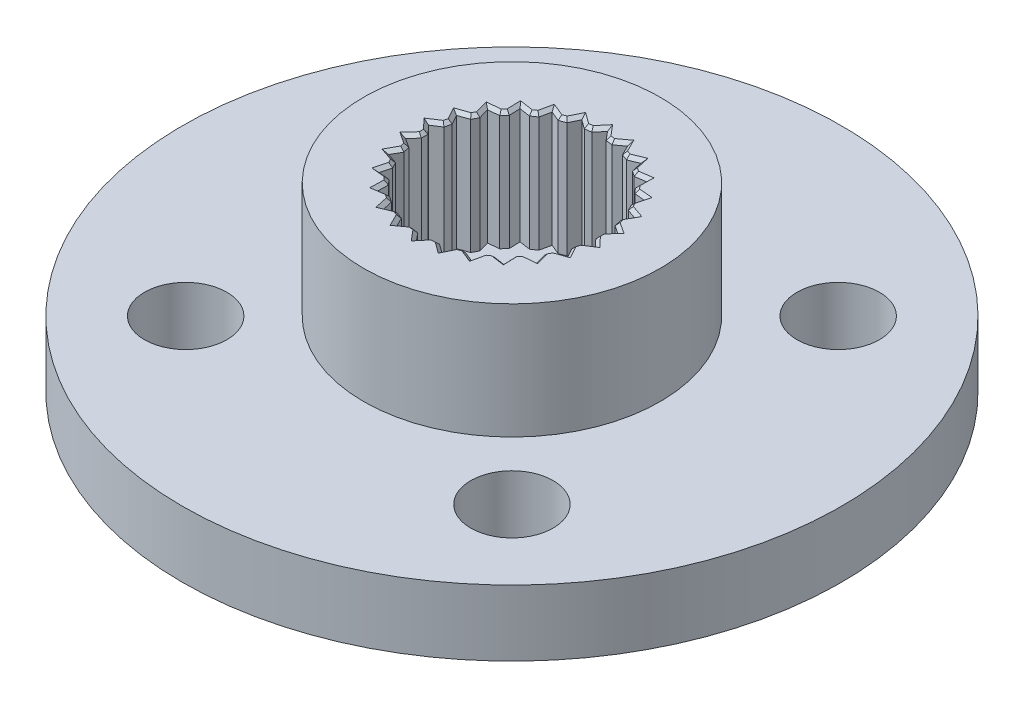
from build123d import *

# Parameters (mm, degrees)
SKETCH1_R           = 10
SKETCH1_R_2         = 1.25
SKETCH1_R_3         = 1.5
BOSS_EXTRUDE1_DEPTH = 2
SKETCH2_R           = 4.5
SKETCH2_R_2         = 1.5
BOSS_EXTRUDE2_DEPTH = 3.5
SKETCH3_R           = 2.25
CUT_EXTRUDE1_DEPTH  = 3.6
CUT_EXTRUDE2_DEPTH  = 3.6
CHAMFER1_SIZE       = 0.1


with BuildPart() as part:
    # Sketch1 → Boss-Extrude1 (new body)
    with BuildSketch(Plane(origin=(0, 0, 0), x_dir=(1, 0, 0), z_dir=(0, 1, 0))):
        with Locations(Location((0, 0, 0), (0, 0, 270))):
            Circle(SKETCH1_R)
        with Locations(Location((-4.949747468, 4.949747468, 0), (0, 0, 270))):
            Circle(SKETCH1_R_2, mode=Mode.SUBTRACT)
        with Locations(Location((4.949747468, 4.949747468, 0), (0, 0, 270))):
            Circle(SKETCH1_R_2, mode=Mode.SUBTRACT)
        with Locations(Location((4.949747468, -4.949747468, 0), (0, 0, 270))):
            Circle(SKETCH1_R_2, mode=Mode.SUBTRACT)
        with Locations(Location((-4.949747468, -4.949747468, 0), (0, 0, 270))):
            Circle(SKETCH1_R_2, mode=Mode.SUBTRACT)
        with Locations(Location((0, 0, 0), (0, 0, 270))):
            Circle(SKETCH1_R_3, mode=Mode.SUBTRACT)
    extrude(amount=BOSS_EXTRUDE1_DEPTH)

    # Sketch2 → Boss-Extrude2 (add)
    with BuildSketch(Plane(origin=(0, 2, 0), x_dir=(1, 0, 0), z_dir=(0, 1, 0))):
        with Locations(Location((0, 0, 0), (0, 0, 270))):
            Circle(SKETCH2_R)
        with Locations(Location((0, 0, 0), (0, 0, 270))):
            Circle(SKETCH2_R_2, mode=Mode.SUBTRACT)
    extrude(amount=BOSS_EXTRUDE2_DEPTH)

    # Sketch3 → Cut-Extrude1 (cut)
    with BuildSketch(Plane(origin=(0, 5.5, 0), x_dir=(1, 0, 0), z_dir=(0, 1, 0))):
        with Locations(Location((0, 0, 0), (0, 0, 270))):
            Circle(SKETCH3_R)
    extrude(amount=-CUT_EXTRUDE1_DEPTH, mode=Mode.SUBTRACT)

    # Sketch7 → Cut-Extrude2 (cut)
    with BuildSketch(Plane(origin=(0, 5.5, 0), x_dir=(1, 0, 0), z_dir=(0, 1, 0))):
        Polygon((-0.842998944, 2.512340101), (-1.034995876, 2.439525269), (-1.129082655, 2.478127827), (-1.347697199, 2.567822474), (-1.398067166, 2.336953865), (-1.419745267, 2.237593211), (-1.588737387, 2.120946373), (-1.689328372, 2.13591077), (-1.923055709, 2.17068117), (-1.916711542, 1.93446686), (-1.913981155, 1.832805537), (-2.050147256, 1.679105783), (-2.151396465, 1.669562343), (-2.386653211, 1.647387766), (-2.32396361, 1.419555673), (-2.296983416, 1.321501868), (-2.392410018, 1.139681668), (-2.488433215, 1.106185022), (-2.711547104, 1.028354172), (-2.59615536, 0.82214507), (-2.54649335, 0.733397313), (-2.595634607, 0.534023397), (-2.680851271, 0.478520248), (-2.878855735, 0.349556373), (-2.717467997, 0.176954384), (-2.648010346, 0.102670372), (-2.648010346, -0.102670372), (-2.717467997, -0.176954384), (-2.878855735, -0.349556373), (-2.680851271, -0.478520248), (-2.595634607, -0.534023397), (-2.54649335, -0.733397313), (-2.59615536, -0.82214507), (-2.711547104, -1.028354172), (-2.488433215, -1.106185022), (-2.392410018, -1.139681668), (-2.296983416, -1.321501868), (-2.32396361, -1.419555673), (-2.386653211, -1.647387766), (-2.151396465, -1.669562343), (-2.050147256, -1.679105783), (-1.913981155, -1.832805537), (-1.916711542, -1.93446686), (-1.923055709, -2.17068117), (-1.689328372, -2.13591077), (-1.588737387, -2.120946373), (-1.419745267, -2.237593211), (-1.398067166, -2.336953865), (-1.347697199, -2.567822474), (-1.129082655, -2.478127827), (-1.034995876, -2.439525269), (-0.842998944, -2.512340101), (-0.798172209, -2.603625605), (-0.694015426, -2.815731271), (-0.503218758, -2.676325101), (-0.421104166, -2.616327824), (-0.217260587, -2.641078915), (-0.151890384, -2.718984089), (0, -2.9), (0.151890384, -2.718984089), (0.217260587, -2.641078915), (0.421104166, -2.616327824), (0.503218758, -2.676325101), (0.694015426, -2.815731271), (0.798172209, -2.603625605), (0.842998944, -2.512340101), (1.034995876, -2.439525269), (1.129082655, -2.478127827), (1.347697199, -2.567822474), (1.398067166, -2.336953865), (1.419745267, -2.237593211), (1.588737387, -2.120946373), (1.689328372, -2.13591077), (1.923055709, -2.17068117), (1.916711542, -1.93446686), (1.913981155, -1.832805537), (2.050147256, -1.679105783), (2.151396465, -1.669562343), (2.386653211, -1.647387766), (2.32396361, -1.419555673), (2.296983416, -1.321501868), (2.392410018, -1.139681668), (2.488433215, -1.106185022), (2.711547104, -1.028354172), (2.59615536, -0.82214507), (2.54649335, -0.733397313), (2.595634607, -0.534023397), (2.680851271, -0.478520248), (2.878855735, -0.349556373), (2.717467997, -0.176954384), (2.648010346, -0.102670372), (2.648010346, 0.102670372), (2.717467997, 0.176954384), (2.878855735, 0.349556373), (2.680851271, 0.478520248), (2.595634607, 0.534023397), (2.54649335, 0.733397313), (2.59615536, 0.82214507), (2.711547104, 1.028354172), (2.488433215, 1.106185022), (2.392410018, 1.139681668), (2.296983416, 1.321501868), (2.32396361, 1.419555673), (2.386653211, 1.647387766), (2.151396465, 1.669562343), (2.050147256, 1.679105783), (1.913981155, 1.832805537), (1.916711542, 1.93446686), (1.923055709, 2.17068117), (1.689328372, 2.13591077), (1.588737387, 2.120946373), (1.419745267, 2.237593211), (1.398067166, 2.336953865), (1.347697199, 2.567822474), (1.129082655, 2.478127827), (1.034995876, 2.439525269), (0.842998944, 2.512340101), (0.798172209, 2.603625605), (0.694015426, 2.815731271), (0.503218758, 2.676325101), (0.421104166, 2.616327824), (0.217260587, 2.641078915), (0.151890384, 2.718984089), (0, 2.9), (-0.151890384, 2.718984089), (-0.217260587, 2.641078915), (-0.421104166, 2.616327824), (-0.503218758, 2.676325101), (-0.694015426, 2.815731271), (-0.798172209, 2.603625605), align=None)
    extrude(amount=-CUT_EXTRUDE2_DEPTH, mode=Mode.SUBTRACT)

    # Chamfer1
    chamfer1_edges = [part.edges().sort_by_distance(p)[0] for p in [
        (-1.504241327, 5.5, 2.179269792),
        (-1.383721233, 5.5, 2.402707843),
        (-1.191346537, 5.5, 2.503673872),
        (-0.93899741, 5.5, 2.475932685),
        (-0.768507185, 5.5, 2.664035686),
        (-0.557559796, 5.5, 2.716029547),
        (-0.319182376, 5.5, 2.62870337),
        (-0.108630293, 5.5, 2.770539458),
        (0.108630293, 5.5, 2.770539458),
        (0.319182376, 5.5, 2.62870337),
        (0.557559796, 5.5, 2.716029547),
        (0.768507185, 5.5, 2.664035686),
        (0.93899741, 5.5, 2.475932685),
        (1.191346537, 5.5, 2.503673872),
        (1.383721233, 5.5, 2.402707843),
        (1.504241327, 5.5, 2.179269792),
        (1.755896548, 5.5, 2.145813771),
        (1.918518432, 5.5, 2.001743353),
        (1.982064206, 5.5, 1.75595566),
        (2.218400233, 5.5, 1.663246774),
        (2.341818314, 5.5, 1.484444817),
        (2.344696717, 5.5, 1.230591768),
        (2.551978561, 5.5, 1.08401792),
        (2.629020227, 5.5, 0.880875743),
        (2.571063978, 5.5, 0.633710355),
        (2.737245171, 5.5, 0.441789885),
        (2.763433041, 5.5, 0.226113373),
        (2.648010346, 5.5, 0),
        (2.763433041, 5.5, -0.226113373),
        (2.737245171, 5.5, -0.441789885),
        (2.571063978, 5.5, -0.633710355),
        (2.629020227, 5.5, -0.880875743),
        (2.551978561, 5.5, -1.08401792),
        (2.344696717, 5.5, -1.230591768),
        (2.341818314, 5.5, -1.484444817),
        (2.218400233, 5.5, -1.663246774),
        (1.982064206, 5.5, -1.75595566),
        (1.918518432, 5.5, -2.001743353),
        (1.755896548, 5.5, -2.145813771),
        (1.504241327, 5.5, -2.179269792),
        (1.383721233, 5.5, -2.402707843),
        (1.191346537, 5.5, -2.503673872),
        (0.93899741, 5.5, -2.475932685),
        (0.768507185, 5.5, -2.664035686),
        (0.557559796, 5.5, -2.716029547),
        (0.319182376, 5.5, -2.62870337),
        (0.108630293, 5.5, -2.770539458),
        (-0.108630293, 5.5, -2.770539458),
        (-0.319182376, 5.5, -2.62870337),
        (-0.557559796, 5.5, -2.716029547),
        (-0.768507185, 5.5, -2.664035686),
        (-0.93899741, 5.5, -2.475932685),
        (-1.191346537, 5.5, -2.503673872),
        (-1.383721233, 5.5, -2.402707843),
        (-1.504241327, 5.5, -2.179269792),
        (-1.755896548, 5.5, -2.145813771),
        (-1.918518432, 5.5, -2.001743353),
        (-1.982064206, 5.5, -1.75595566),
        (-2.218400233, 5.5, -1.663246774),
        (-2.341818314, 5.5, -1.484444817),
        (-2.344696717, 5.5, -1.230591768),
        (-2.551978561, 5.5, -1.08401792),
        (-2.629020227, 5.5, -0.880875743),
        (-2.571063978, 5.5, -0.633710355),
        (-2.737245171, 5.5, -0.441789885),
        (-2.763433041, 5.5, -0.226113373),
        (-2.648010346, 5.5, 0),
        (-2.763433041, 5.5, 0.226113373),
        (-2.737245171, 5.5, 0.441789885),
        (-2.571063978, 5.5, 0.633710355),
        (-2.629020227, 5.5, 0.880875743),
        (-2.551978561, 5.5, 1.08401792),
        (-2.344696717, 5.5, 1.230591768),
        (-2.341818314, 5.5, 1.484444817),
        (-2.218400233, 5.5, 1.663246774),
        (-1.982064206, 5.5, 1.75595566),
        (-1.918518432, 5.5, 2.001743353),
        (-1.755896548, 5.5, 2.145813771),
    ]]
    chamfer(chamfer1_edges, length=CHAMFER1_SIZE)


solid = part.part
